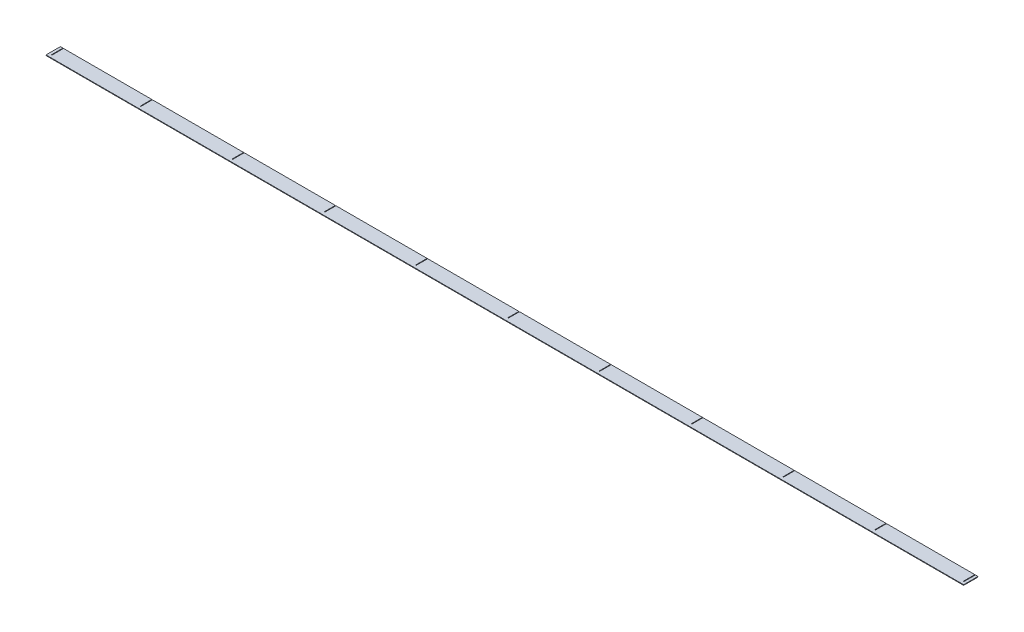
from build123d import *

# Parameters (mm, degrees)
BOSS_EXTRUDE1_DEPTH = 1


with BuildPart() as part:
    # Sketch2 → Boss-Extrude1 (new body)
    with BuildSketch(Plane(origin=(0, 0, 0), x_dir=(1, 0, 0), z_dir=(0, 1, 0))):
        Polygon((-800, -12.5), (-800, 12.5), (-795.5, 12.5), (-795.5, -7.5), (-794.5, -7.5), (-794.5, 12.5), (-640.5, 12.5), (-640.5, -7.5), (-639.5, -7.5), (-639.5, 12.5), (-480.5, 12.5), (-480.5, -7.5), (-479.5, -7.5), (-479.5, 12.5), (-320.5, 12.5), (-320.5, -7.5), (-319.5, -7.5), (-319.5, 12.5), (-160.5, 12.5), (-160.5, -7.5), (-159.5, -7.5), (-159.5, 12.5), (-0.5, 12.5), (-0.5, -7.5), (0.5, -7.5), (0.5, 12.5), (159.5, 12.5), (159.5, -7.5), (160.5, -7.5), (160.5, 12.5), (319.5, 12.5), (319.5, -7.5), (320.5, -7.5), (320.5, 12.5), (479.5, 12.5), (479.5, -7.5), (480.5, -7.5), (480.5, 12.5), (639.5, 12.5), (639.5, -7.5), (640.5, -7.5), (640.5, 12.5), (794.5, 12.5), (794.5, -7.5), (795.5, -7.5), (795.5, 12.5), (800, 12.5), (800, -12.5), align=None)
    extrude(amount=BOSS_EXTRUDE1_DEPTH)


solid = part.part
